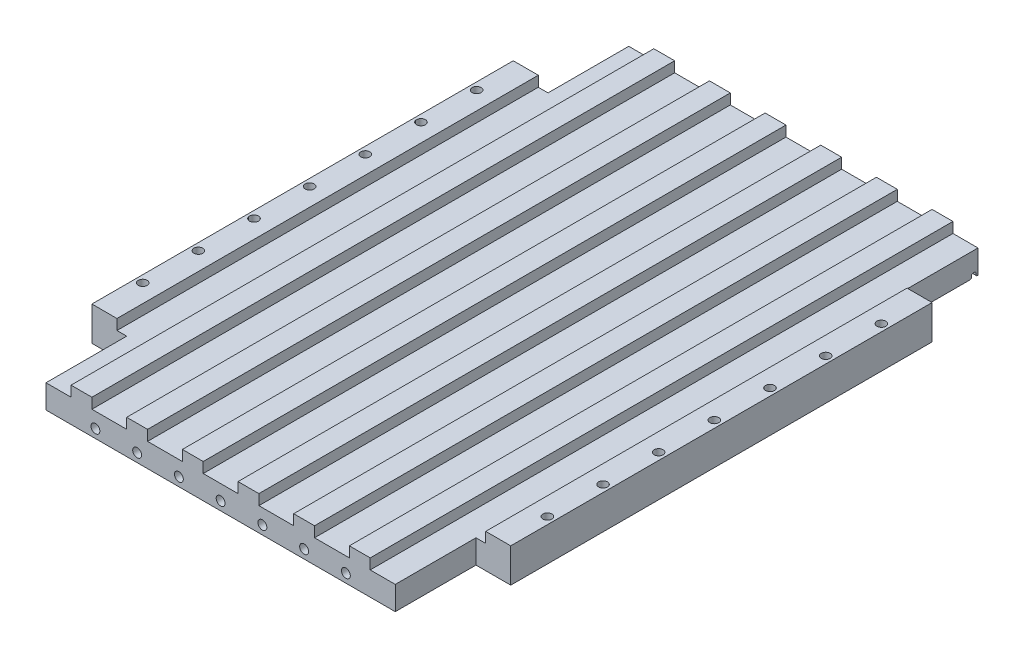
from build123d import *

# Parameters (mm, degrees)
SKETCH1_W      = 76.454
SKETCH1_H      = 106.3752
EXTRUDE1_DEPTH = 6.223
SKETCH2_W      = 6.35
SKETCH2_H      = 14.732
EXTRUDE2_DEPTH = 132.147333256
SKETCH3_R      = 0.8128
EXTRUDE3_DEPTH = 9.525
SKETCH5_R      = 0.8128
EXTRUDE4_DEPTH = 132.147333256
SKETCH7_W      = 63.754
SKETCH7_H      = 0.79375
EXTRUDE5_DEPTH = 0.79375
CHAMFER1_SIZE  = 0.1778
SKETCH8_W      = 6.35
SKETCH8_H      = 106.3752
EXTRUDE7_DEPTH = 1.905


with BuildPart() as part:
    # Sketch1 → Extrude1 (new body)
    with BuildSketch(Plane(origin=(0, 0, 0), x_dir=(1, 0, 0), z_dir=(0, 1, 0))):
        with Locations((38.227, 53.1876)):
            Rectangle(SKETCH1_W, SKETCH1_H)
    extrude(amount=-EXTRUDE1_DEPTH)

    # Sketch2 → Extrude2 (cut, through all)
    with BuildSketch(Plane(origin=(0, 0, 0), x_dir=(-1, 0, 0), z_dir=(0, 1, 0))):
        with Locations((-3.175, -7.366)):
            Rectangle(SKETCH2_W, SKETCH2_H)
        with Locations((-73.279, -7.366)):
            Rectangle(SKETCH2_W, SKETCH2_H)
        with Locations((-73.279, -99.0092)):
            Rectangle(SKETCH2_W, SKETCH2_H)
        with Locations((-3.175, -99.0092)):
            Rectangle(SKETCH2_W, SKETCH2_H)
    extrude(amount=-EXTRUDE2_DEPTH, mode=Mode.SUBTRACT)

    # Sketch3 → Extrude3 (cut)
    with BuildSketch(Plane.XY):
        with Locations((15.367, -4.6355)):
            Circle(SKETCH3_R)
        with Locations((22.987, -4.6355)):
            Circle(SKETCH3_R)
        with Locations((30.607, -4.6355)):
            Circle(SKETCH3_R)
        with Locations((38.227, -4.6355)):
            Circle(SKETCH3_R)
        with Locations((45.847, -4.6355)):
            Circle(SKETCH3_R)
        with Locations((53.467, -4.6355)):
            Circle(SKETCH3_R)
        with Locations((61.087, -4.6355)):
            Circle(SKETCH3_R)
    extrude(amount=-EXTRUDE3_DEPTH, mode=Mode.SUBTRACT)

    # Sketch5 → Extrude4 (cut, through all)
    with BuildSketch(Plane(origin=(0, 0, 0), x_dir=(1, 0, 0), z_dir=(0, 1, 0))):
        with Locations(Location((1.28905, 83.6676, 0), (0, 0, 270))):
            Circle(SKETCH5_R)
        with Locations(Location((1.28905, 63.3476, 0), (0, 0, 270))):
            Circle(SKETCH5_R)
        with Locations(Location((1.28905, 53.1876, 0), (0, 0, 270))):
            Circle(SKETCH5_R)
        with Locations(Location((1.28905, 73.5076, 0), (0, 0, 270))):
            Circle(SKETCH5_R)
        with Locations(Location((1.28905, 32.8676, 0), (0, 0, 270))):
            Circle(SKETCH5_R)
        with Locations(Location((1.28905, 22.7076, 0), (0, 0, 270))):
            Circle(SKETCH5_R)
        with Locations(Location((75.16495, 83.6676, 0), (0, 0, 90))):
            Circle(SKETCH5_R)
        with Locations(Location((75.16495, 73.5076, 0), (0, 0, 90))):
            Circle(SKETCH5_R)
        with Locations(Location((75.16495, 63.3476, 0), (0, 0, 90))):
            Circle(SKETCH5_R)
        with Locations(Location((75.16495, 53.1876, 0), (0, 0, 90))):
            Circle(SKETCH5_R)
        with Locations(Location((75.16495, 43.0276, 0), (0, 0, 90))):
            Circle(SKETCH5_R)
        with Locations(Location((75.16495, 32.8676, 0), (0, 0, 90))):
            Circle(SKETCH5_R)
        with Locations(Location((75.16495, 22.7076, 0), (0, 0, 90))):
            Circle(SKETCH5_R)
        with Locations(Location((1.28905, 43.0276, 0), (0, 0, 270))):
            Circle(SKETCH5_R)
    extrude(amount=-EXTRUDE4_DEPTH, mode=Mode.SUBTRACT)

    # Sketch7 → Extrude5 (cut)
    with BuildSketch(Plane.XZ.offset(6.223)):
        with Locations((38.227, -105.5878)):
            Rectangle(SKETCH7_W, SKETCH7_H)
    extrude(amount=-EXTRUDE5_DEPTH, mode=Mode.SUBTRACT)

    # Chamfer1
    chamfer1_edges = [part.edges().sort_by_distance(p)[0] for p in [
        (38.227, -5.42925, -105.190925),
        (38.227, -5.42925, -105.984675),
        (38.227, -6.223, -105.984675),
        (38.227, -6.223, -105.190925),
    ]]
    chamfer(chamfer1_edges, length=CHAMFER1_SIZE)

    # Sketch8 → Extrude7 (cut)
    with BuildSketch(Plane(origin=(0, 0, 0), x_dir=(-1, 0, 0), z_dir=(0, 1, 0))):
        Polygon((-10.922, 0), (-10.922, -106.3752), (-6.35, -106.3752), (-6.35, -91.6432), (-4.572, -91.6432), (-4.572, -14.732), (-6.35, -14.732), (-6.35, 0), align=None)
        with Locations((-17.907, -53.1876)):
            Rectangle(SKETCH8_W, SKETCH8_H)
        with Locations((-28.067, -53.1876)):
            Rectangle(SKETCH8_W, SKETCH8_H)
        with Locations((-38.227, -53.1876)):
            Rectangle(SKETCH8_W, SKETCH8_H)
        with Locations((-58.547, -53.1876)):
            Rectangle(SKETCH8_W, SKETCH8_H)
        Polygon((-70.104, -106.3752), (-65.532, -106.3752), (-65.532, 0), (-70.104, 0), (-70.104, -14.732), (-71.882, -14.732), (-71.882, -91.6432), (-70.104, -91.6432), align=None)
        with Locations((-48.387, -53.1876)):
            Rectangle(SKETCH8_W, SKETCH8_H)
    extrude(amount=-EXTRUDE7_DEPTH, mode=Mode.SUBTRACT)


solid = part.part
